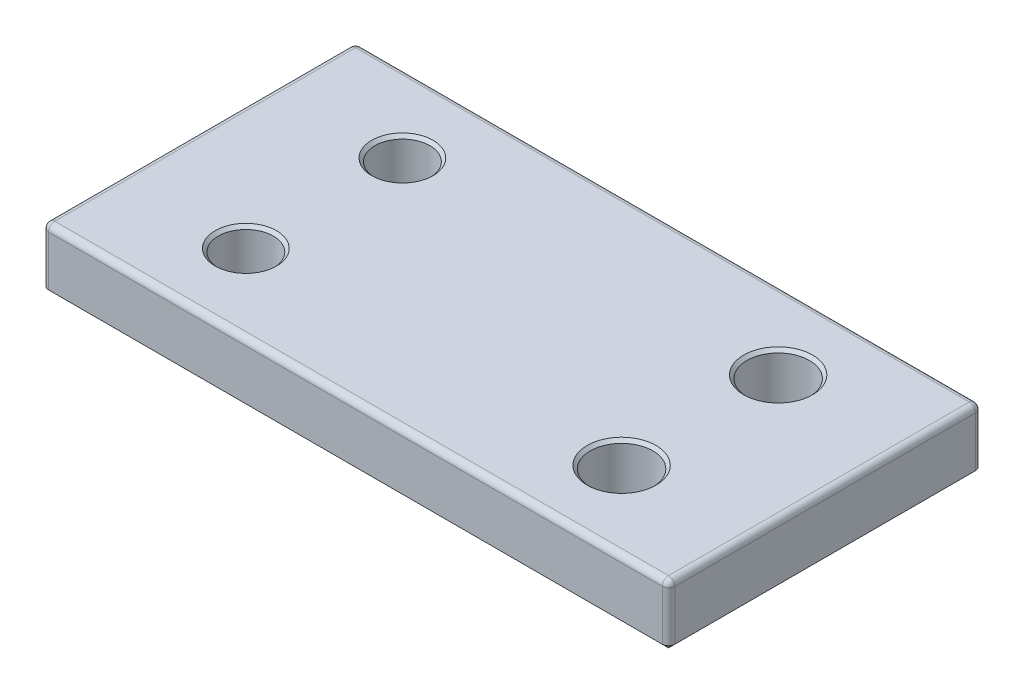
from build123d import *

# Parameters (mm, degrees)
BOSS_EXTRUDE1_DEPTH        = 5
FILLET1_R                  = 1
CHAMFER2_SIZE              = 1
M10X1_25_TAPPED_HOLE1_D    = 8.8
F_10_0_10_DIAMETER_HOLE1_D = 10
CHAMFER3_SIZE              = 0.5


with BuildPart() as part:
    # Sketch2 → Boss-Extrude1 (new, symmetric)
    with BuildSketch(Plane(origin=(0, 0, 0), x_dir=(1, 0, 0), z_dir=(0, 1, 0))):
        with BuildLine():
            Line((49, 25), (-49, 25))
            ThreePointArc((-49, 25), (-49.707106781, 24.707106781), (-50, 24))
            Line((-50, 24), (-50, -24))
            ThreePointArc((-50, -24), (-49.707106781, -24.707106781), (-49, -25))
            Line((-49, -25), (49, -25))
            ThreePointArc((49, -25), (49.707106781, -24.707106781), (50, -24))
            Line((50, -24), (50, 24))
            ThreePointArc((50, 24), (49.707106781, 24.707106781), (49, 25))
        make_face()
    extrude(amount=BOSS_EXTRUDE1_DEPTH, both=True)

    # Fillet1
    fillet1_edges = [part.edges().sort_by_distance(p)[0] for p in [
        (0, 5, -25),
        (49.707106781, 5, -24.707106781),
        (50, 5, 0),
        (49.707106781, 5, 24.707106781),
        (0, 5, 25),
        (-49.707106781, 5, 24.707106781),
        (-50, 5, 0),
        (-49.707106781, 5, -24.707106781),
    ]]
    fillet(fillet1_edges, radius=FILLET1_R)

    # Chamfer2
    chamfer2_edges = [part.edges().sort_by_distance(p)[0] for p in [
        (-50, -5, 0),
        (-49.707106781, -5, 24.707106781),
        (0, -5, 25),
        (49.707106781, -5, 24.707106781),
        (50, -5, 0),
        (49.707106781, -5, -24.707106781),
        (0, -5, -25),
        (-49.707106781, -5, -24.707106781),
    ]]
    chamfer(chamfer2_edges, length=CHAMFER2_SIZE)

    # M10x1.25 Tapped Hole1 (through all)
    with Locations(Plane(origin=(-30, 5, -12.5), x_dir=(0, 0, 1), z_dir=(0, 1, 0))):
        with Locations((0, 0), (25, 0)):
            Hole(M10X1_25_TAPPED_HOLE1_D / 2)

    # Ø10.0 (10) Diameter Hole1 (through all)
    with Locations(Plane(origin=(30, 5, -12.5), x_dir=(0, 0, 1), z_dir=(0, 1, 0))):
        with Locations((0, 0), (25, 0)):
            Hole(F_10_0_10_DIAMETER_HOLE1_D / 2)

    # Chamfer3
    chamfer3_edges = [part.edges().sort_by_distance(p)[0] for p in [
        (30, 5, 17.5),
        (30, 5, -7.5),
        (-30, 5, 16.9),
        (-30, 5, -8.1),
    ]]
    chamfer(chamfer3_edges, length=CHAMFER3_SIZE)


solid = part.part
